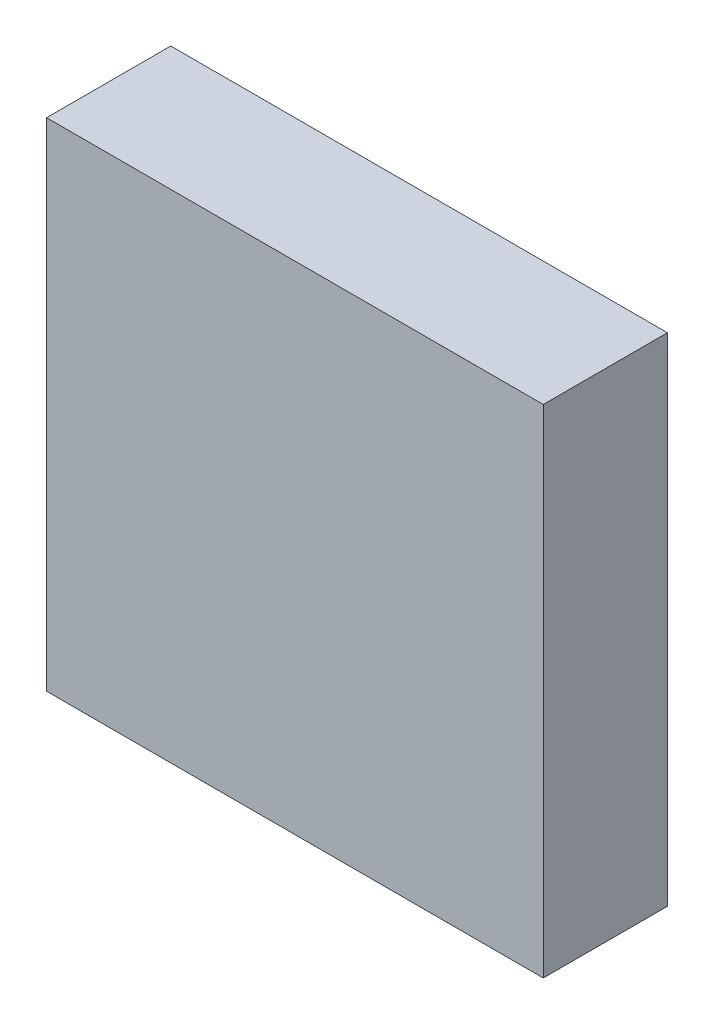
from build123d import *

# Parameters (mm, degrees)
SKETCH1_W           = 50.8
SKETCH1_H           = 50.8
BOSS_EXTRUDE1_DEPTH = 12.7


with BuildPart() as part:
    # Sketch1 → Boss-Extrude1 (new body)
    with BuildSketch(Plane.XY):
        with Locations((25.4, 25.4)):
            Rectangle(SKETCH1_W, SKETCH1_H)
    extrude(amount=BOSS_EXTRUDE1_DEPTH)


solid = part.part
